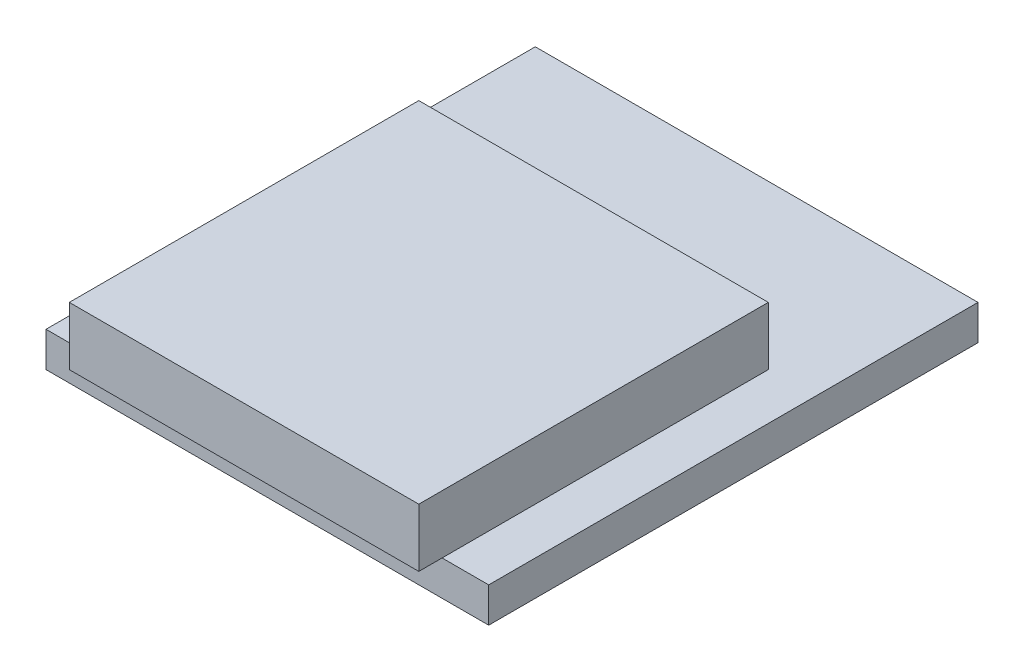
from build123d import *

# Parameters (mm, degrees)
SKETCH1_W           = 15
SKETCH1_H           = 15
BOSS_EXTRUDE1_DEPTH = 2.5
SKETCH2_W           = 19
SKETCH2_H           = 21
BOSS_EXTRUDE2_DEPTH = 1.5


with BuildPart() as part:
    # Sketch1 → Boss-Extrude1 (new body)
    with BuildSketch(Plane(origin=(0, 0, 0), x_dir=(1, 0, 0), z_dir=(0, 1, 0))):
        Rectangle(SKETCH1_W, SKETCH1_H)
    extrude(amount=BOSS_EXTRUDE1_DEPTH)

    # Sketch2 → Boss-Extrude2 (add)
    with BuildSketch(Plane.XZ):
        with Locations((0, -4)):
            Rectangle(SKETCH2_W, SKETCH2_H)
    extrude(amount=BOSS_EXTRUDE2_DEPTH)


solid = part.part
